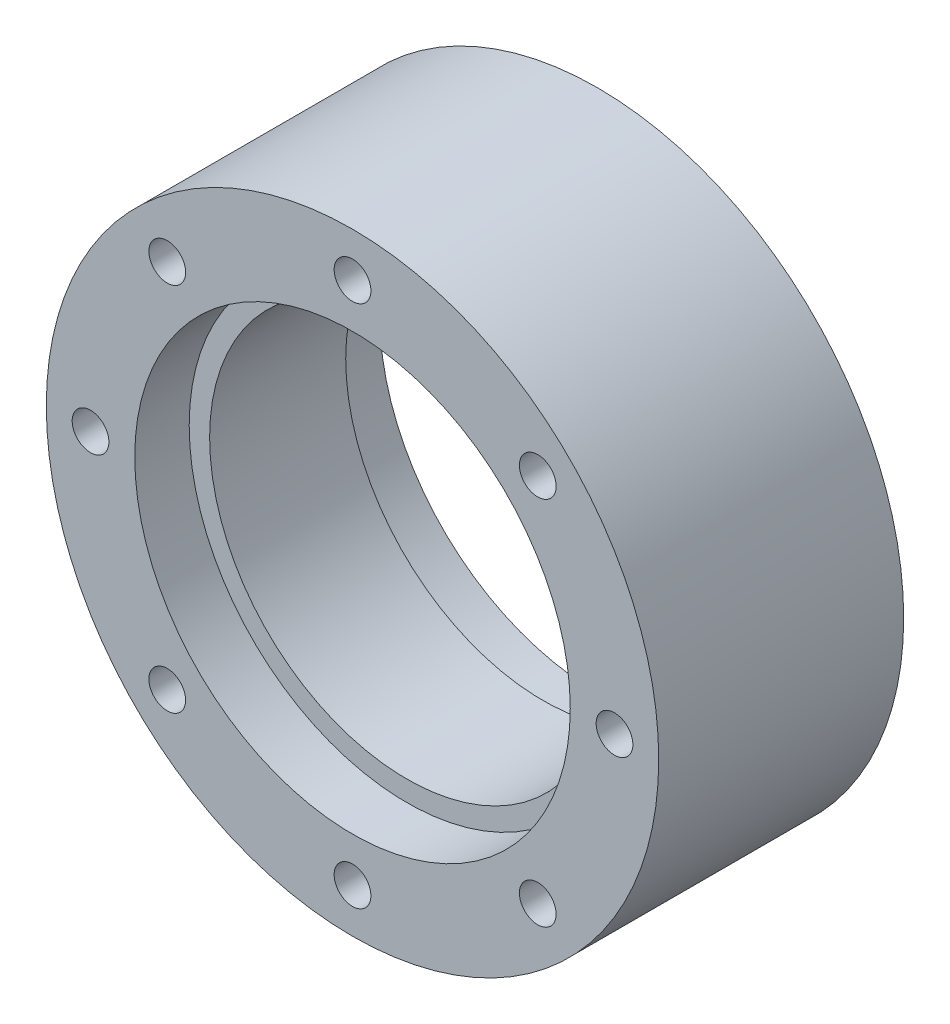
from build123d import *

# Parameters (mm, degrees)
SKETCH3_R          = 1.35
CUT_EXTRUDE2_DEPTH = 34.068111528
CUT_EXTRUDE4_START = -2.5
SKETCH4_R          = 2.25
CUT_EXTRUDE4_DEPTH = 40.058172821
CHAMFER1_SIZE      = 0.1
CIRPATTERN3_COUNT  = 4
CIRPATTERN2_COUNT  = 8


with BuildPart() as part:
    # Sketch7 → Revolve1 (revolve)
    with BuildSketch(Plane(origin=(0, 0, 0), x_dir=(1, 0, 0), z_dir=(0, 1, 0))):
        Polygon((16, 9), (16, 5), (14.5, 5), (14.5, -5), (16, -5), (16, -9), (22.5, -9), (22.5, 9), align=None)
    revolve(axis=Axis((0, 0, 9.9), (0, 0, -1)))

    # Sketch3 → Cut-Extrude2 (cut, symmetric)
    with BuildSketch(Plane.XY):
        with Locations((0, 19.25)):
            Circle(SKETCH3_R)
    cut_extrude2 = extrude(amount=CUT_EXTRUDE2_DEPTH, both=True, mode=Mode.SUBTRACT)

    # Sketch4 → Cut-Extrude4 (cut)
    with BuildSketch(Plane(origin=(0, 0, -9), x_dir=(-1, 0, 0), z_dir=(0, 0, -1)).offset(CUT_EXTRUDE4_START)):
        with Locations(Location((0, 19.25, 0), (0, 0, 180))):
            Circle(SKETCH4_R)
    cut_extrude4 = extrude(amount=CUT_EXTRUDE4_DEPTH, mode=Mode.SUBTRACT)

    # Chamfer1
    chamfer1_edges = [part.edges().sort_by_distance(p)[0] for p in [
        (-1.35, 19.25, -6.5),
    ]]
    chamfer(chamfer1_edges, length=CHAMFER1_SIZE)

    # CirPattern3: Cut-Extrude4 ×4 about axis
    cirpattern3_axis = Axis((0, 0, 0), (0, 0, 1))
    for i in range(1, CIRPATTERN3_COUNT):
        add(cut_extrude4.rotate(cirpattern3_axis, i * 360 / CIRPATTERN3_COUNT), mode=Mode.SUBTRACT)

    # CirPattern2: Cut-Extrude2 ×8 about axis
    cirpattern2_axis = Axis((0, 0, 0), (0, 0, 1))
    for i in range(1, CIRPATTERN2_COUNT):
        add(cut_extrude2.rotate(cirpattern2_axis, i * 360 / CIRPATTERN2_COUNT), mode=Mode.SUBTRACT)


solid = part.part
